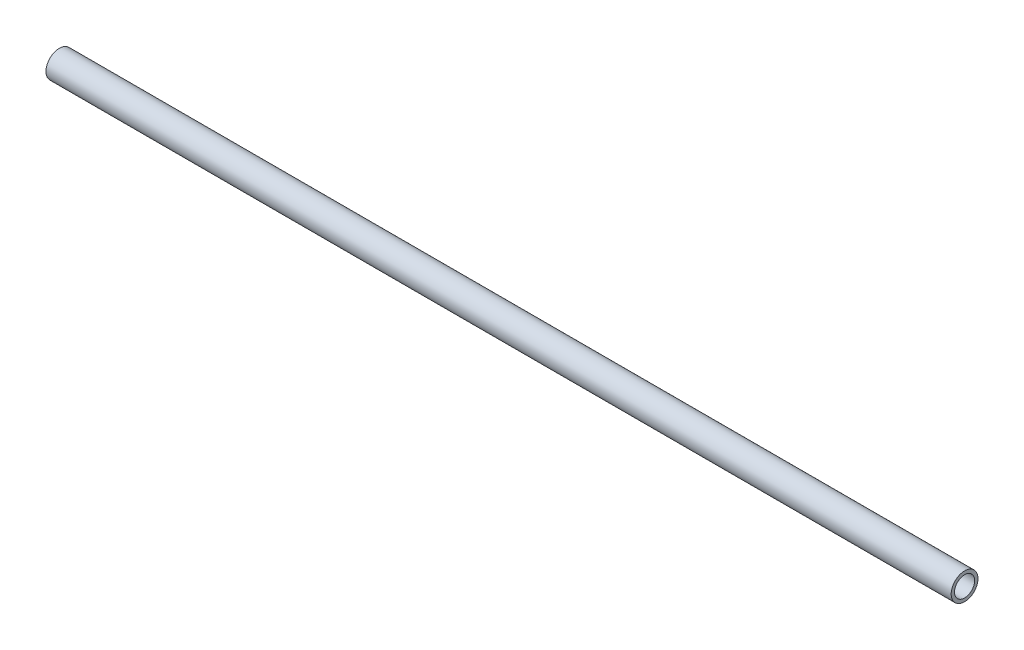
from build123d import *

# Parameters (mm, degrees)
SKETCH1_R           = 4
SKETCH1_R_2         = 3
BOSS_EXTRUDE1_DEPTH = 135


with BuildPart() as part:
    # Sketch1 → Boss-Extrude1 (new, symmetric)
    with BuildSketch(Plane(origin=(0, 0, 0), x_dir=(0, 0, -1), z_dir=(1, 0, 0))):
        Circle(SKETCH1_R)
        Circle(SKETCH1_R_2, mode=Mode.SUBTRACT)
    extrude(amount=BOSS_EXTRUDE1_DEPTH, both=True)


solid = part.part
